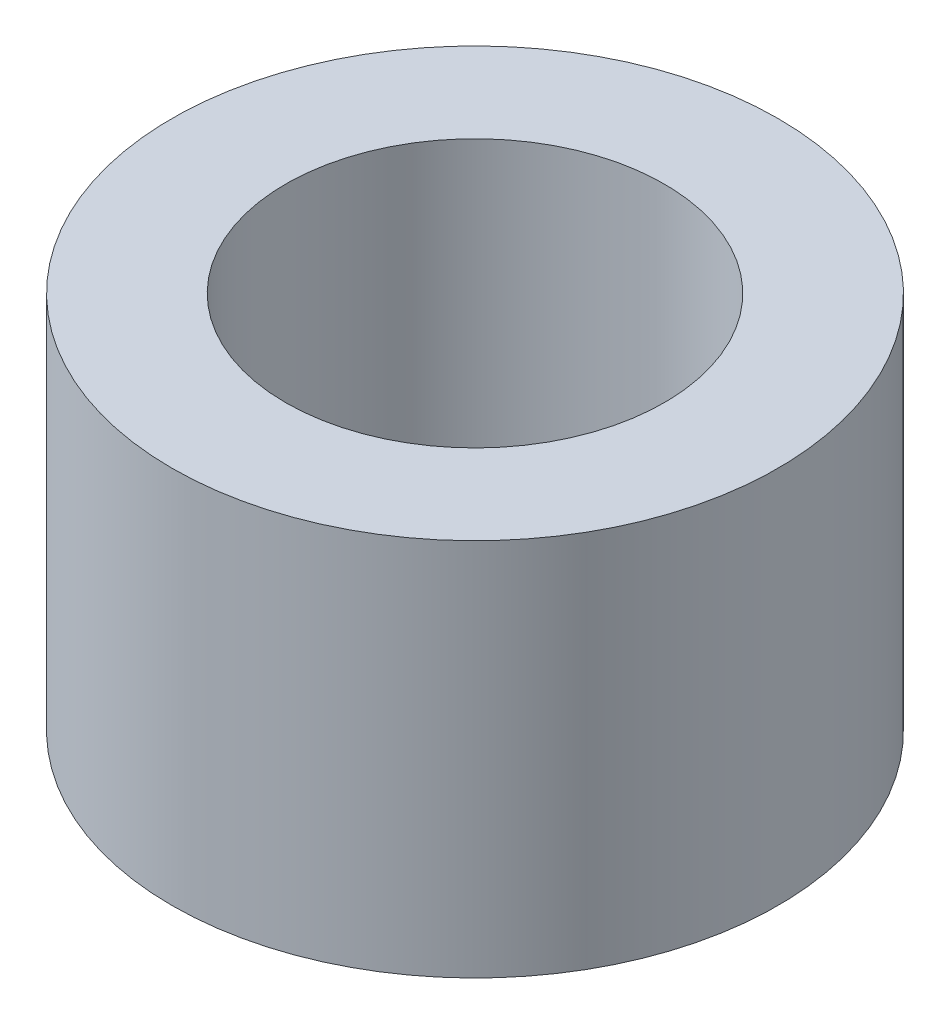
from build123d import *

# Parameters (mm, degrees)
SKETCH1_R           = 5.08
SKETCH1_R_2         = 3.175
BOSS_EXTRUDE1_DEPTH = 6.35


with BuildPart() as part:
    # Sketch1 → Boss-Extrude1 (new body)
    with BuildSketch(Plane(origin=(0, 0, 0), x_dir=(1, 0, 0), z_dir=(0, 1, 0))):
        with Locations(Location((0, 0, 0), (0, 0, 270))):
            Circle(SKETCH1_R)
        with Locations(Location((0, 0, 0), (0, 0, 270))):
            Circle(SKETCH1_R_2, mode=Mode.SUBTRACT)
    extrude(amount=BOSS_EXTRUDE1_DEPTH)


solid = part.part
